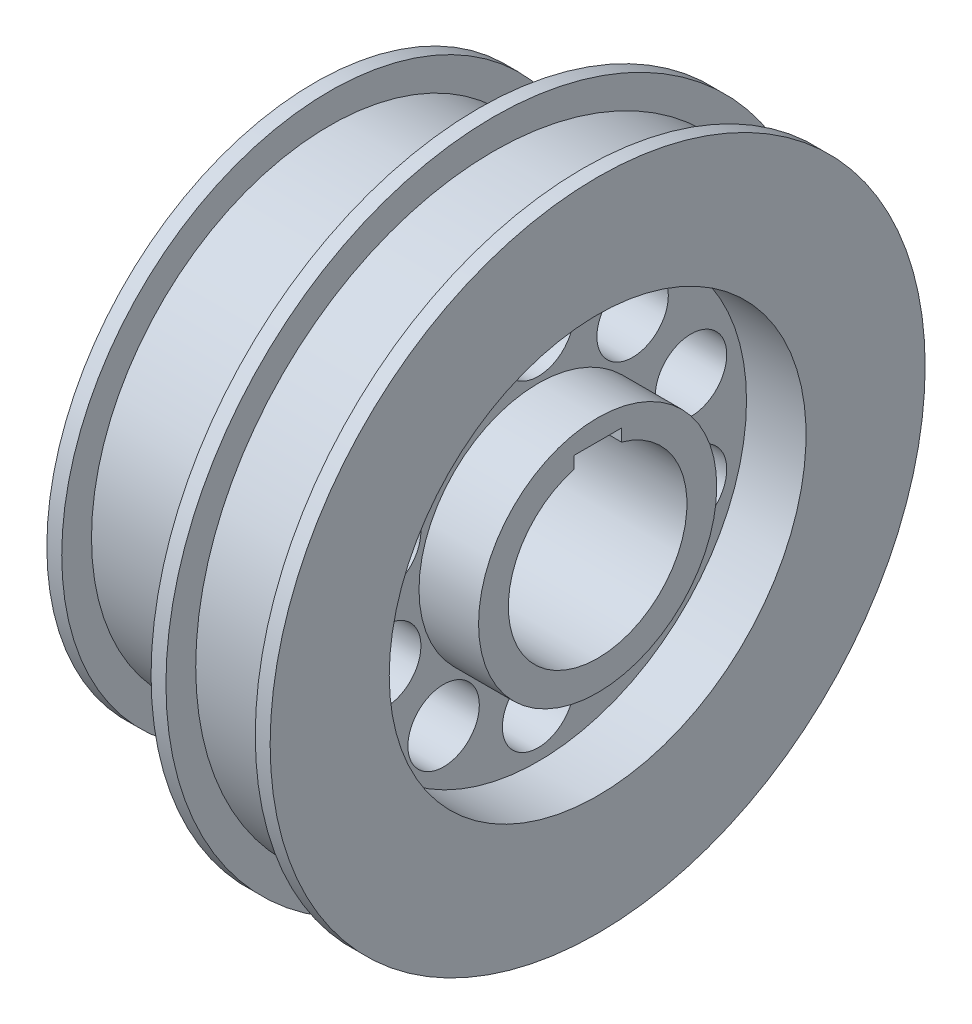
from build123d import *

# Parameters (mm, degrees)
BOSS_EXTRUDE1_DEPTH      = 15
BOSS_EXTRUDE1_DEPTH_BACK = 15
SKETCH1_R                = 20
SKETCH2_R                = 20
SKETCH2_R_2              = 6.5
BOSS_EXTRUDE2_DEPTH      = 5
BOSS_EXTRUDE3_DEPTH      = 5
BOSS_EXTRUDE3_DEPTH_BACK = 5
SKETCH3_R                = 40
SKETCH3_R_2              = 6
SKETCH3_R_3              = 17.5
FILLET1_R                = 2.5


with BuildPart() as part:
    # Sketch1 → Boss-Extrude1 (new, two sides: drawn at the far end of the back side and taken through both)
    with BuildSketch(Plane(origin=(0, 0, 0), x_dir=(0, 0, -1), z_dir=(1, 0, 0)).offset(-BOSS_EXTRUDE1_DEPTH_BACK)):
        Circle(SKETCH1_R)
        with BuildLine():
            Line((-4, 14.456832295), (-4, 16.5))
            Line((-4, 16.5), (4, 16.5))
            Line((4, 16.5), (4, 14.456832295))
            ThreePointArc((4, 14.456832295), (0, -15), (-4, 14.456832295))
        make_face(mode=Mode.SUBTRACT)
    extrude(amount=BOSS_EXTRUDE1_DEPTH + BOSS_EXTRUDE1_DEPTH_BACK)

    # Sketch2 → Boss-Extrude2 (add)
    with BuildSketch(Plane.ZY.offset(15)):
        Circle(SKETCH2_R)
        Circle(SKETCH2_R_2, mode=Mode.SUBTRACT)
    extrude(amount=-BOSS_EXTRUDE2_DEPTH)

    # Sketch3 → Boss-Extrude3 (add, two sides: drawn at the far end of the back side and taken through both)
    with BuildSketch(Plane(origin=(0, 0, 0), x_dir=(0, 0, -1), z_dir=(1, 0, 0)).offset(-BOSS_EXTRUDE3_DEPTH_BACK)):
        Circle(SKETCH3_R)
        with Locations((0, 27)):
            Circle(SKETCH3_R_2, mode=Mode.SUBTRACT)
        Circle(SKETCH3_R_3, mode=Mode.SUBTRACT)
        with Locations((15.870201812, 21.843458848)):
            Circle(SKETCH3_R_2, mode=Mode.SUBTRACT)
        with Locations((25.67852594, 8.343458848)):
            Circle(SKETCH3_R_2, mode=Mode.SUBTRACT)
        with Locations((25.67852594, -8.343458848)):
            Circle(SKETCH3_R_2, mode=Mode.SUBTRACT)
        with Locations((15.870201812, -21.843458848)):
            Circle(SKETCH3_R_2, mode=Mode.SUBTRACT)
        with Locations((0, -27)):
            Circle(SKETCH3_R_2, mode=Mode.SUBTRACT)
        with Locations((-15.870201812, -21.843458848)):
            Circle(SKETCH3_R_2, mode=Mode.SUBTRACT)
        with Locations((-25.67852594, -8.343458848)):
            Circle(SKETCH3_R_2, mode=Mode.SUBTRACT)
        with Locations((-25.67852594, 8.343458848)):
            Circle(SKETCH3_R_2, mode=Mode.SUBTRACT)
        with Locations((-15.870201812, 21.843458848)):
            Circle(SKETCH3_R_2, mode=Mode.SUBTRACT)
    extrude(amount=BOSS_EXTRUDE3_DEPTH + BOSS_EXTRUDE3_DEPTH_BACK)

    # Sketch5 → Revolve1 (revolve)
    with BuildSketch(Plane.XY):
        Polygon((-32.5, 35), (-32.5, 45), (-30, 45), (-30, 40), (-5, 40), (-5, 55), (-2.5, 55), (-2.5, 50), (12.5, 50), (12.5, 55), (15, 55), (15, 35), align=None)
    revolve(axis=Axis((0, 0, 0), (1, 0, 0)))

    # Fillet1
    fillet1_edges = [part.edges().sort_by_distance(p)[0] for p in [
        (-15, 0, 20),
    ]]
    fillet(fillet1_edges, radius=FILLET1_R)


solid = part.part
